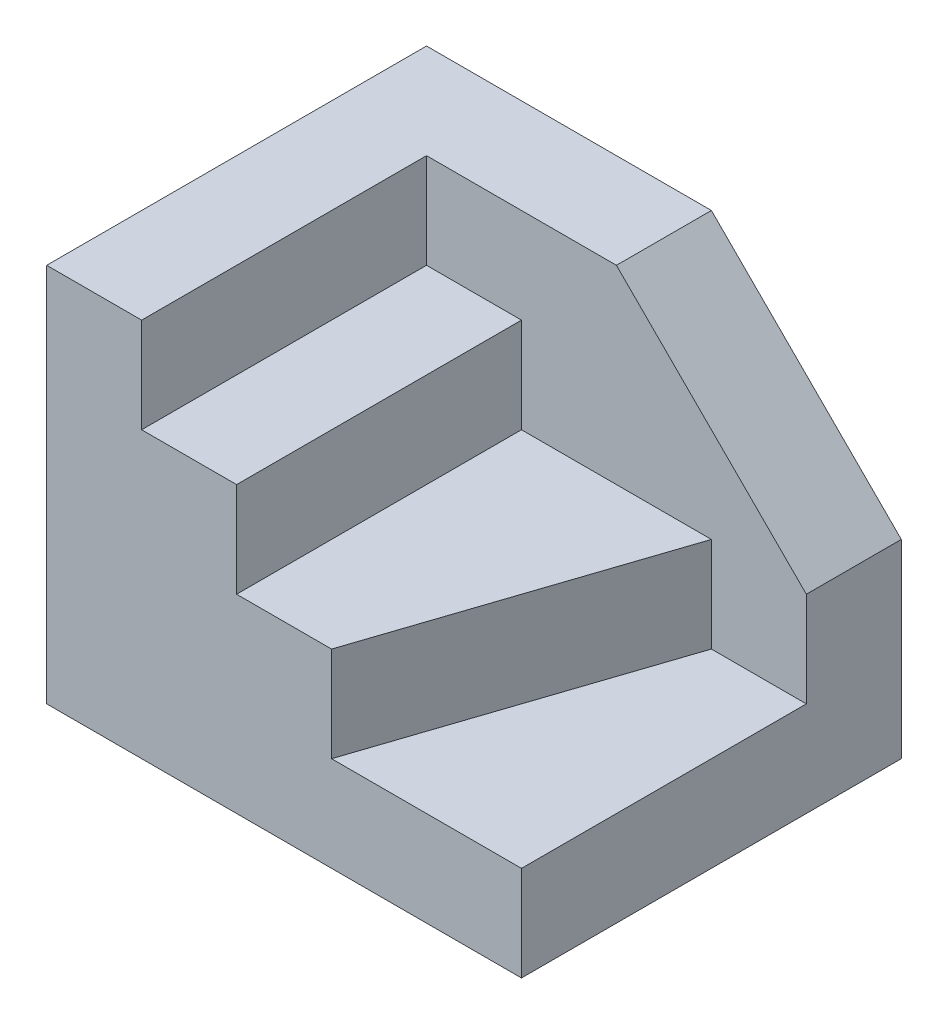
from build123d import *

# Parameters (mm, degrees)
SKETCH_1_W      = 25
SKETCH_1_H      = 20
EXTRUDE_1_DEPTH = 5
SKETCH_2_W      = 5
SKETCH_2_H      = 15
SKETCH_2_H_2    = 5
SKETCH_2_W_2    = 10
EXTRUDE_2_DEPTH = 15
EXTRUDE_3_DEPTH = 5
SKETCH_4_W      = 5
SKETCH_4_H      = 10
EXTRUDE_4_DEPTH = 15
EXTRUDE_6_DEPTH = 5


with BuildPart() as part:
    # 草圖1 → 填料-伸長1 (new body)
    with BuildSketch(Plane(origin=(0, 0, 0), x_dir=(1, 0, 0), z_dir=(0, 1, 0))):
        with Locations((12.5, -10)):
            Rectangle(SKETCH_1_W, SKETCH_1_H)
    extrude(amount=EXTRUDE_1_DEPTH)

    # 草圖2 → 填料-伸長2 (add)
    with BuildSketch(Plane(origin=(0, 5, 0), x_dir=(1, 0, 0), z_dir=(0, 1, 0))):
        with Locations((2.5, -12.5)):
            Rectangle(SKETCH_2_W, SKETCH_2_H)
        with Locations((2.5, -2.5)):
            Rectangle(SKETCH_2_W, SKETCH_2_H_2)
        with Locations((10, -2.5)):
            Rectangle(SKETCH_2_W_2, SKETCH_2_H_2)
    extrude(amount=EXTRUDE_2_DEPTH)

    # 草圖3 → 填料-伸長3 (add)
    with BuildSketch(Plane.XY.offset(5)):
        Polygon((15, 20), (15, 5), (25, 5), (25, 10), align=None)
    extrude(amount=-EXTRUDE_3_DEPTH)

    # 草圖4 → 填料-伸長4 (add)
    with BuildSketch(Plane.XY.offset(20)):
        with Locations((7.5, 10)):
            Rectangle(SKETCH_4_W, SKETCH_4_H)
    extrude(amount=-EXTRUDE_4_DEPTH)

    # 草圖5 → 填料-伸長6 (add)
    with BuildSketch(Plane(origin=(0, 5, 0), x_dir=(1, 0, 0), z_dir=(0, 1, 0))):
        Polygon((10, -20), (15, -20), (20, -5), (10, -5), align=None)
    extrude(amount=EXTRUDE_6_DEPTH)


solid = part.part
